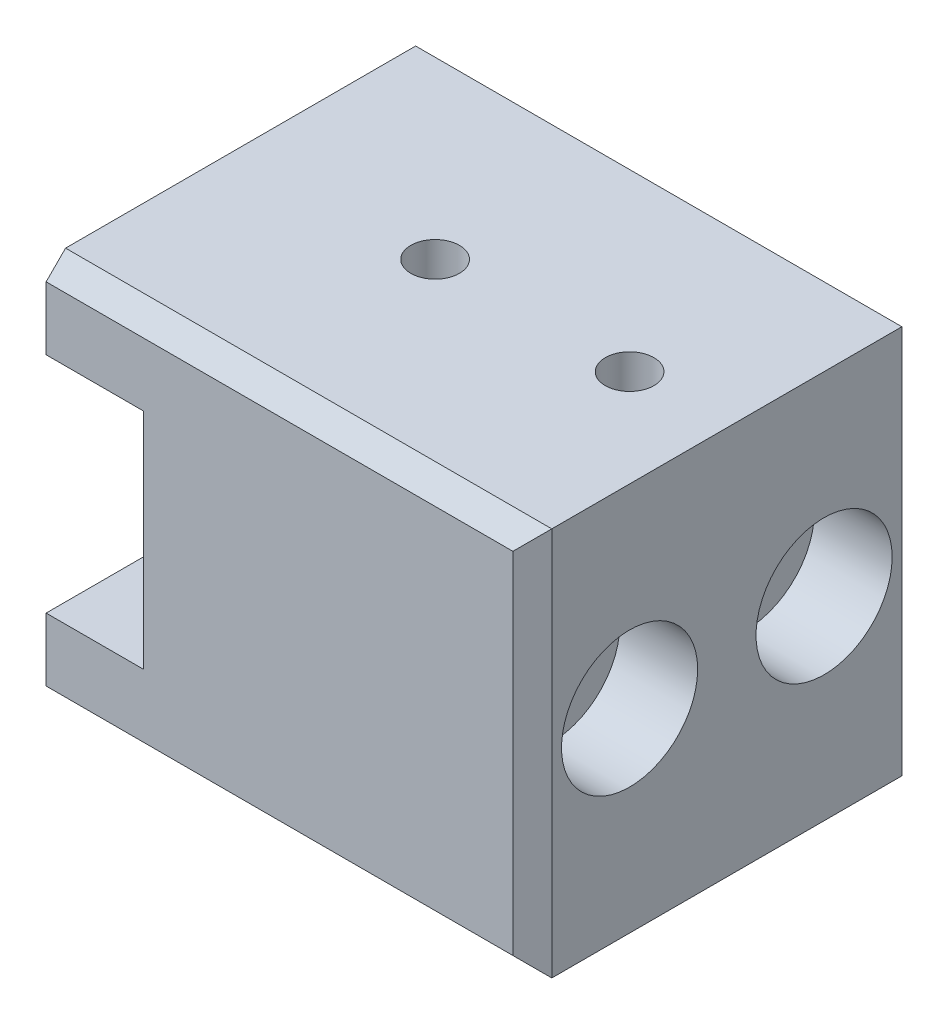
from build123d import *

# Parameters (mm, degrees)
SKETCH_1_W          = 20
SKETCH_1_H          = 20
EXTRUDE_1_DEPTH     = 25
SKETCH_2_W          = 20
SKETCH_2_H          = 11.5
CUT_EXTRUDE_1_DEPTH = 5
SKETCH_3_R          = 1.25
CUT_EXTRUDE_2_DEPTH = 25.494897428
SKETCH_4_R          = 1.25
CUT_EXTRUDE_3_DEPTH = 34.541019662
CHAMFER_1_SIZE      = 1
SKETCH_6_R          = 3.5
CUT_EXTRUDE_4_DEPTH = 4


with BuildPart() as part:
    # 草图1 → 凸台-拉伸1 (new body)
    with BuildSketch(Plane(origin=(0, 0, 0), x_dir=(0, 0, -1), z_dir=(1, 0, 0))):
        Rectangle(SKETCH_1_W, SKETCH_1_H)
    extrude(amount=EXTRUDE_1_DEPTH)

    # 草图2 → 切除-拉伸1 (cut)
    with BuildSketch(Plane.ZY):
        Rectangle(SKETCH_2_W, SKETCH_2_H)
    extrude(amount=-CUT_EXTRUDE_1_DEPTH, mode=Mode.SUBTRACT)

    # 草图3 → 切除-拉伸2 (cut, through all)
    with BuildSketch(Plane.ZY.offset(-5)):
        with Locations((-5, 0)):
            Circle(SKETCH_3_R)
        with Locations((5, 0)):
            Circle(SKETCH_3_R)
    extrude(amount=-CUT_EXTRUDE_2_DEPTH, mode=Mode.SUBTRACT)

    # 草图4 → 切除-拉伸3 (cut, through all)
    with BuildSketch(Plane(origin=(0, 10, 0), x_dir=(1, 0, 0), z_dir=(0, 1, 0))):
        with Locations(Location((20, 0, 0), (0, 0, 270))):
            Circle(SKETCH_4_R)
        with Locations(Location((10, 0, 0), (0, 0, 270))):
            Circle(SKETCH_4_R)
    extrude(amount=-CUT_EXTRUDE_3_DEPTH, mode=Mode.SUBTRACT)

    # 倒角1
    chamfer_1_edges = [part.edges().sort_by_distance(p)[0] for p in [
        (25, 0, -10),
        (25, 0, 10),
        (12.5, 10, 10),
        (12.5, 10, -10),
        (12.5, -10, -10),
        (12.5, -10, 10),
    ]]
    chamfer(chamfer_1_edges, length=CHAMFER_1_SIZE)

    # 草图6 → 切除-拉伸4 (cut)
    with BuildSketch(Plane(origin=(25, 0, 0), x_dir=(0, 0, -1), z_dir=(1, 0, 0))):
        with Locations((-5, 0)):
            Circle(SKETCH_6_R)
        with Locations((5, 0)):
            Circle(SKETCH_6_R)
    extrude(amount=-CUT_EXTRUDE_4_DEPTH, mode=Mode.SUBTRACT)


solid = part.part
